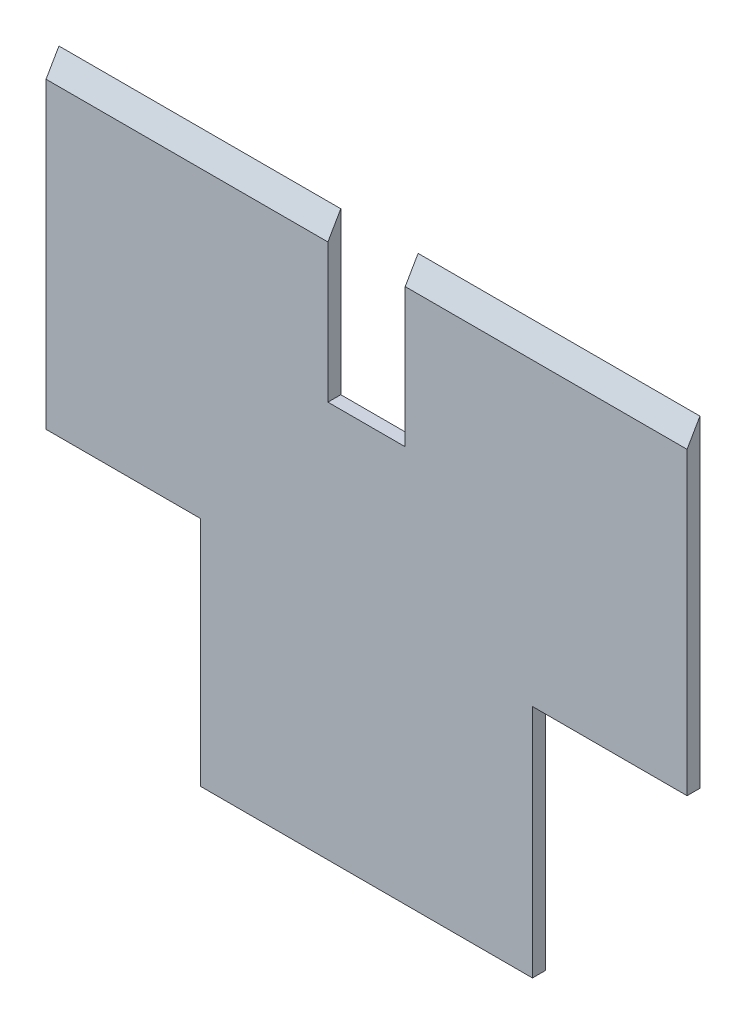
from build123d import *

# Parameters (mm, degrees)
SALIENTE_EXTRUIR1_DEPTH = 2
CORTAR_EXTRUIR2_START   = -100
CORTAR_EXTRUIR2_DEPTH   = 100
CORTAR_EXTRUIR3_DEPTH   = 2
CROQUIS7_W              = 12
CROQUIS7_H              = 25
CORTAR_EXTRUIR4_DEPTH   = 2
CORTAR_EXTRUIR5_START   = -51.502837
CROQUIS9_W              = 2
CROQUIS9_H              = 6
CORTAR_EXTRUIR5_DEPTH   = 51.502837


with BuildPart() as part:
    # Croquis1 → Saliente-Extruir1 (new body)
    with BuildSketch(Plane.XY):
        Polygon((100, 100), (100, 42), (76, 42), (76, 0), (24, 0), (24, 42), (0, 42), (0, 100), align=None)
    extrude(amount=SALIENTE_EXTRUIR1_DEPTH)

    # Croquis4 → Cortar-Extruir2 (cut)
    with BuildSketch(Plane.ZY.offset(CORTAR_EXTRUIR2_START)):
        Polygon((2, 89.065555864), (2, 91.065555864), (2, 93.066666667), (2, 100), (0, 100), (0, 96.533333333), (0, 94.532222531), (0, 92.532222531), align=None)
    extrude(amount=CORTAR_EXTRUIR2_DEPTH, mode=Mode.SUBTRACT)

    # Croquis6 → Cortar-Extruir3 (cut)
    with BuildSketch(Plane(origin=(0, 0, 0), x_dir=(-1, 0, 0), z_dir=(0, 0, -1))):
        Polygon((-100, 92.532222531), (-99.5, 92.532222531), (-99.5, 42.5), (-75.502836605, 42.5), (-75.502836605, 0), (-76, 0), (-76, 42), (-100, 42), align=None)
    extrude(amount=-CORTAR_EXTRUIR3_DEPTH, mode=Mode.SUBTRACT)

    # Croquis7 → Cortar-Extruir4 (cut)
    with BuildSketch(Plane(origin=(0, 0, 0), x_dir=(-1, 0, 0), z_dir=(0, 0, -1))):
        with Locations((-49.75, 80.032222531)):
            Rectangle(CROQUIS7_W, CROQUIS7_H)
    extrude(amount=-CORTAR_EXTRUIR4_DEPTH, mode=Mode.SUBTRACT)

    # Croquis9 → Cortar-Extruir5 (cut)
    with BuildSketch(Plane(origin=(75.502836605, 0, 0), x_dir=(0, 0, -1), z_dir=(1, 0, 0)).offset(CORTAR_EXTRUIR5_START)):
        with Locations((-1, 3)):
            Rectangle(CROQUIS9_W, CROQUIS9_H)
    extrude(amount=CORTAR_EXTRUIR5_DEPTH, mode=Mode.SUBTRACT)


solid = part.part
